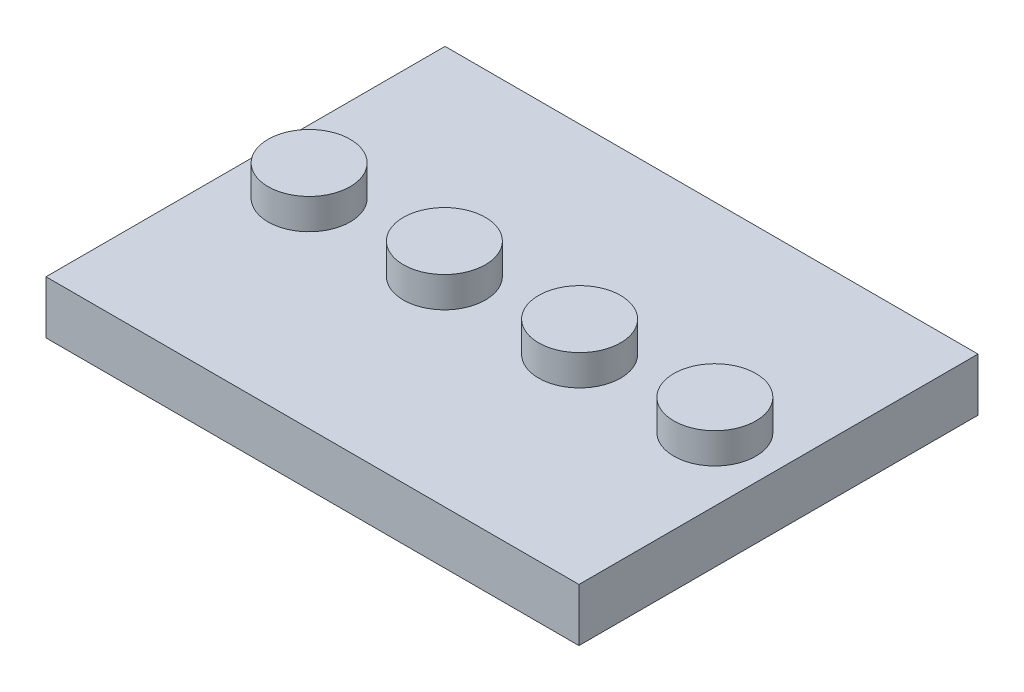
from build123d import *

# Parameters (mm, degrees)
SKETCH2_W           = 31.88
SKETCH2_H           = 23.87
BOSS_EXTRUDE1_DEPTH = 3.17
SKETCH3_R           = 2.455
BOSS_EXTRUDE2_DEPTH = 1.83
SHELL1_T            = -1.5
SKETCH4_R           = 3.24
SKETCH4_R_2         = 2.41
BOSS_EXTRUDE3_DEPTH = 1.47


with BuildPart() as part:
    # Sketch2 → Boss-Extrude1 (new body)
    with BuildSketch(Plane(origin=(0, 0, 0), x_dir=(1, 0, 0), z_dir=(0, 1, 0))):
        Rectangle(SKETCH2_W, SKETCH2_H)
    extrude(amount=-BOSS_EXTRUDE1_DEPTH)

    # Sketch3 → Boss-Extrude2 (add)
    with BuildSketch(Plane(origin=(0, 0, 0), x_dir=(1, 0, 0), z_dir=(0, 1, 0))):
        with Locations(Location((-12.135, 0, 0), (0, 0, 270))):
            Circle(SKETCH3_R)
        with Locations(Location((-4.045, 0, 0), (0, 0, 270))):
            Circle(SKETCH3_R)
        with Locations(Location((4.045, 0, 0), (0, 0, 270))):
            Circle(SKETCH3_R)
        with Locations(Location((12.135, 0, 0), (0, 0, 270))):
            Circle(SKETCH3_R)
    extrude(amount=BOSS_EXTRUDE2_DEPTH)

    # Shell1
    shell1_openings = [part.faces().sort_by_distance(p)[0] for p in [
        (0, -3.17, 0),
    ]]
    offset(amount=SHELL1_T, openings=shell1_openings, kind=Kind.INTERSECTION)

    # Sketch4 → Boss-Extrude3 (add)
    # profile 1 of 6: a face of its own
    with BuildSketch(Plane.XZ.offset(1.5)):
        with Locations(Location((-7.97, 3.978333333, 0), (0, 0, 90))):
            Circle(SKETCH4_R)
        with Locations(Location((-7.97, 3.978333333, 0), (0, 0, 90))):
            Circle(SKETCH4_R_2, mode=Mode.SUBTRACT)
    # profile 2 of 6: a face of its own
    with BuildSketch(Plane.XZ.offset(1.5)):
        with Locations(Location((0, 3.978333333, 0), (0, 0, 90))):
            Circle(SKETCH4_R)
        with Locations(Location((0, 3.978333333, 0), (0, 0, 90))):
            Circle(SKETCH4_R_2, mode=Mode.SUBTRACT)
    # profile 3 of 6: a face of its own
    with BuildSketch(Plane.XZ.offset(1.5)):
        with Locations(Location((7.97, 3.978333333, 0), (0, 0, 90))):
            Circle(SKETCH4_R)
        with Locations(Location((7.97, 3.978333333, 0), (0, 0, 90))):
            Circle(SKETCH4_R_2, mode=Mode.SUBTRACT)
    # profile 4 of 6: a face of its own
    with BuildSketch(Plane.XZ.offset(1.5)):
        with Locations(Location((0, -3.981666667, 0), (0, 0, 90))):
            Circle(SKETCH4_R)
        with Locations(Location((0, -3.981666667, 0), (0, 0, 90))):
            Circle(SKETCH4_R_2, mode=Mode.SUBTRACT)
    # profile 5 of 6: a face of its own
    with BuildSketch(Plane.XZ.offset(1.5)):
        with Locations(Location((7.97, -3.981666667, 0), (0, 0, 90))):
            Circle(SKETCH4_R)
        with Locations(Location((7.97, -3.981666667, 0), (0, 0, 90))):
            Circle(SKETCH4_R_2, mode=Mode.SUBTRACT)
    # profile 6 of 6: a face of its own
    with BuildSketch(Plane.XZ.offset(1.5)):
        with Locations(Location((-7.97, -3.981666667, 0), (0, 0, 90))):
            Circle(SKETCH4_R)
        with Locations(Location((-7.97, -3.981666667, 0), (0, 0, 90))):
            Circle(SKETCH4_R_2, mode=Mode.SUBTRACT)
    extrude(amount=BOSS_EXTRUDE3_DEPTH)


solid = part.part
